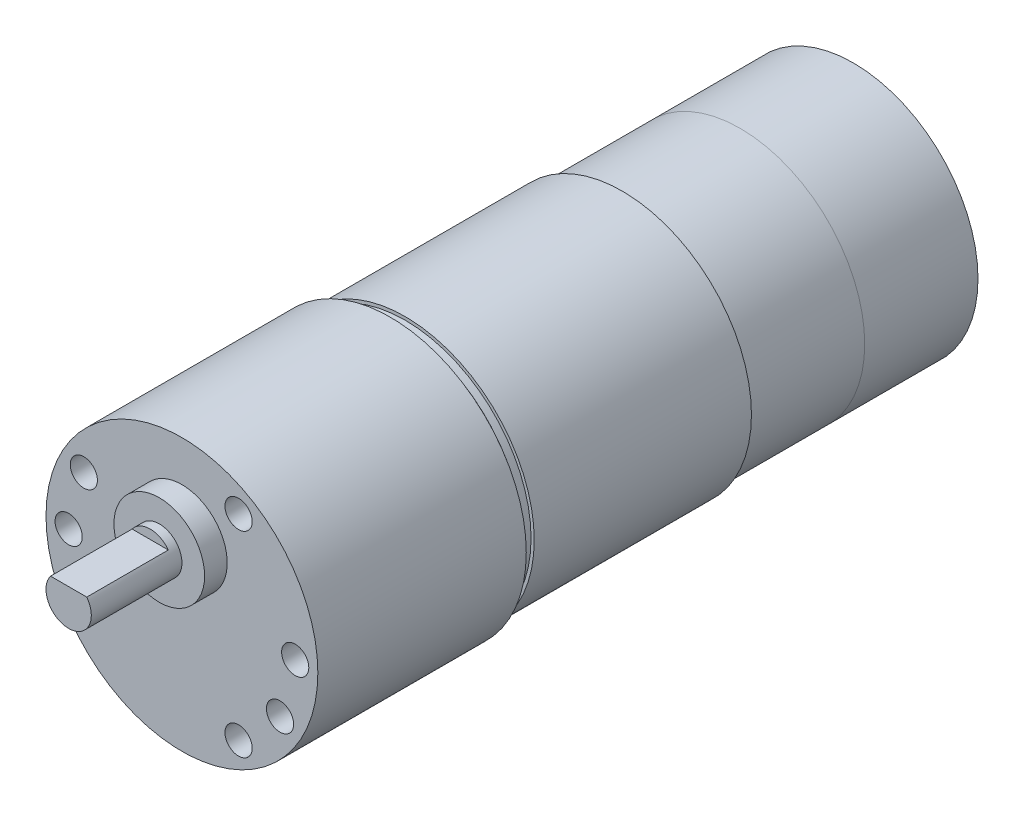
from build123d import *

# Parameters (mm, degrees)
SKETCH_3_R          = 13.75
EXTRUDE_1_DEPTH     = 12.5
SKETCH_4_R          = 1.5
CUT_EXTRUDE_1_DEPTH = 4
SKETCH_5_R          = 5
EXTRUDE_2_DEPTH     = 2.5
SKETCH_6_R          = 2.5
EXTRUDE_3_DEPTH     = 10
CUT_EXTRUDE_2_DEPTH = 9


with BuildPart() as part:
    # Эскиз2 → Повернуть1 (revolve)
    with BuildSketch(Plane(origin=(0, 0, 0), x_dir=(0, 0, -1), z_dir=(1, 0, 0)), mode=Mode.PRIVATE) as revolve_1_sk:
        Polygon((0, 0), (0, 15), (23, 15), (23, 13.160869224), (23.8, 13.160869224), (23.8, 13.900188548), (24.629157433, 13.900188548), (24.629157433, 14.25), (48.6, 14.25), (48.6, 13.75), (61.6, 13.75), (61.6, 0), align=None)
    revolve(revolve_1_sk.sketch.rotate(Axis((0, 0, 0), (0, 0, -1)), 90), axis=Axis((0, 0, 0), (0, 0, -1)))

    # Эскиз4 → Вырез-Вытянуть1 (cut)
    with BuildSketch(Plane.XY):
        with Locations((-12.5, 0)):
            Circle(SKETCH_4_R)
        with Locations((-10.825317547, 6.25)):
            Circle(SKETCH_4_R)
        with Locations((6.25, 10.825317547)):
            Circle(SKETCH_4_R)
        with Locations((12.5, 0)):
            Circle(SKETCH_4_R)
        with Locations((10.825317547, -6.25)):
            Circle(SKETCH_4_R)
        with Locations((6.25, -10.825317547)):
            Circle(SKETCH_4_R)
    extrude(amount=-CUT_EXTRUDE_1_DEPTH, mode=Mode.SUBTRACT)

    # Эскиз5 → Бобышка-Вытянуть2 (add)
    with BuildSketch(Plane.XY):
        with Locations(Location((0, 5.5, 0), (0, 0, 180))):
            Circle(SKETCH_5_R)
    extrude(amount=EXTRUDE_2_DEPTH)

    # Эскиз6 → Бобышка-Вытянуть3 (add)
    with BuildSketch(Plane.XY.offset(2.5)):
        with Locations((0, 5.5)):
            Circle(SKETCH_6_R)
    extrude(amount=EXTRUDE_3_DEPTH)

    # Эскиз7 → Вырез-Вытянуть2 (cut)
    with BuildSketch(Plane.XY.offset(12.5)):
        Polygon((-2.640466968, 7), (2.828249594, 7), (2.828249594, 8.822905521), (-1.513579919, 8.822905521), align=None)
    extrude(amount=-CUT_EXTRUDE_2_DEPTH, mode=Mode.SUBTRACT)


with BuildPart() as body_2:
    # Эскиз3 → Бобышка-Вытянуть1 (new body)
    with BuildSketch(Plane(origin=(0, 0, -61.6), x_dir=(-1, 0, 0), z_dir=(0, 0, -1))):
        Circle(SKETCH_3_R)
    extrude(amount=EXTRUDE_1_DEPTH)


solid = Compound([part.part, body_2.part])
